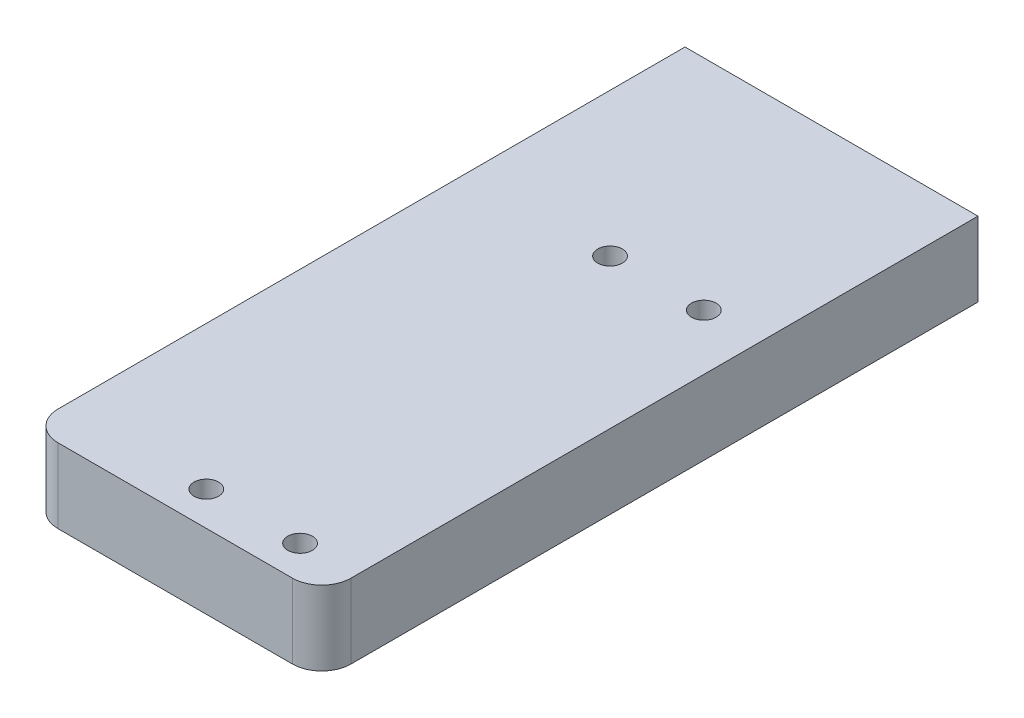
from build123d import *

# Parameters (mm, degrees)
SKETCH12_W                = 50
SKETCH12_H                = 12.7
BOSS_EXTRUDE1_DEPTH       = 112
M5X0_8_TAPPED_HOLE2_D     = 4.2
M5X0_8_TAPPED_HOLE2_DEPTH = 14.4
M5X0_8_TAPPED_HOLE2_TIP   = 1.2618073
M5X0_8_TAPPED_HOLE3_D     = 4.2
SKETCH19_W                = 34
SKETCH19_H                = 52.9
CUT_EXTRUDE1_DEPTH        = 9.7
FILLET1_R                 = 5


with BuildPart() as part:
    # Sketch12 → Boss-Extrude1 (new body)
    with BuildSketch(Plane.XY):
        Rectangle(SKETCH12_W, SKETCH12_H)
    extrude(amount=BOSS_EXTRUDE1_DEPTH)

    # M5x0.8 Tapped Hole2
    with Locations(Plane(origin=(0, 0, 0), x_dir=(-1, 0, 0), z_dir=(0, 0, -1))):
        with Locations((-17.5, 0), (0, 0), (17.5, 0)):
            Hole(M5X0_8_TAPPED_HOLE2_D / 2, depth=M5X0_8_TAPPED_HOLE2_DEPTH)
            with Locations((0, 0, -(M5X0_8_TAPPED_HOLE2_DEPTH + M5X0_8_TAPPED_HOLE2_TIP / 2))):  # 118° drill point
                Cone(0, M5X0_8_TAPPED_HOLE2_D / 2, M5X0_8_TAPPED_HOLE2_TIP, mode=Mode.SUBTRACT)

    # M5x0.8 Tapped Hole3 (through all)
    with Locations(Plane(origin=(0, 6.35, 0), x_dir=(1, 0, 0), z_dir=(0, 1, 0))):
        with Locations((-0.5, -37.3), (15.5, -37.3), (15.5, -106.2), (-0.5, -106.2)):
            Hole(M5X0_8_TAPPED_HOLE3_D / 2)

    # Sketch19 → Cut-Extrude1 (cut)
    with BuildSketch(Plane(origin=(0, -6.35, 0), x_dir=(1, 0, 0), z_dir=(0, 1, 0))):
        with Locations((0, -71.75)):
            Rectangle(SKETCH19_W, SKETCH19_H)
    extrude(amount=CUT_EXTRUDE1_DEPTH, mode=Mode.SUBTRACT)

    # Fillet1
    fillet1_edges = [part.edges().sort_by_distance(p)[0] for p in [
        (-25, 0, 112),
        (25, 0, 112),
        (-17, -1.5, 45.3),
        (-17, -1.5, 98.2),
        (17, -1.5, 98.2),
        (17, -1.5, 45.3),
    ]]
    fillet(fillet1_edges, radius=FILLET1_R)


solid = part.part
